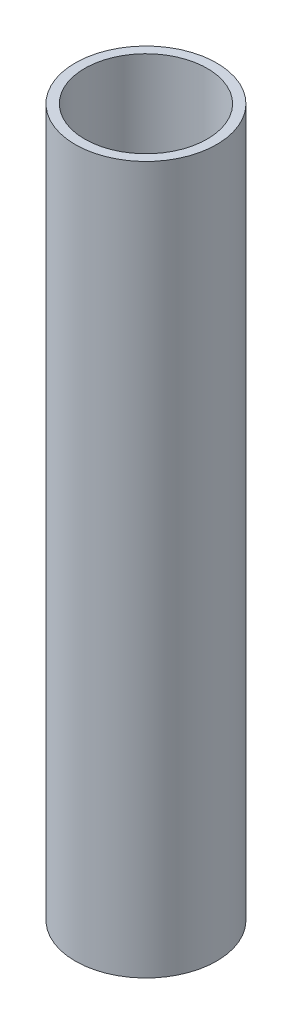
from build123d import *

# Parameters (mm, degrees)
SKETCH1_R           = 7.5
SKETCH1_R_2         = 6.5
BOSS_EXTRUDE1_DEPTH = 37.5


with BuildPart() as part:
    # Sketch1 → Boss-Extrude1 (new, symmetric)
    with BuildSketch(Plane(origin=(0, 0, 0), x_dir=(1, 0, 0), z_dir=(0, 1, 0))):
        with Locations(Location((0, 0, 0), (0, 0, 270))):
            Circle(SKETCH1_R)
        with Locations(Location((0, 0, 0), (0, 0, 270))):
            Circle(SKETCH1_R_2, mode=Mode.SUBTRACT)
    extrude(amount=BOSS_EXTRUDE1_DEPTH, both=True)


solid = part.part
